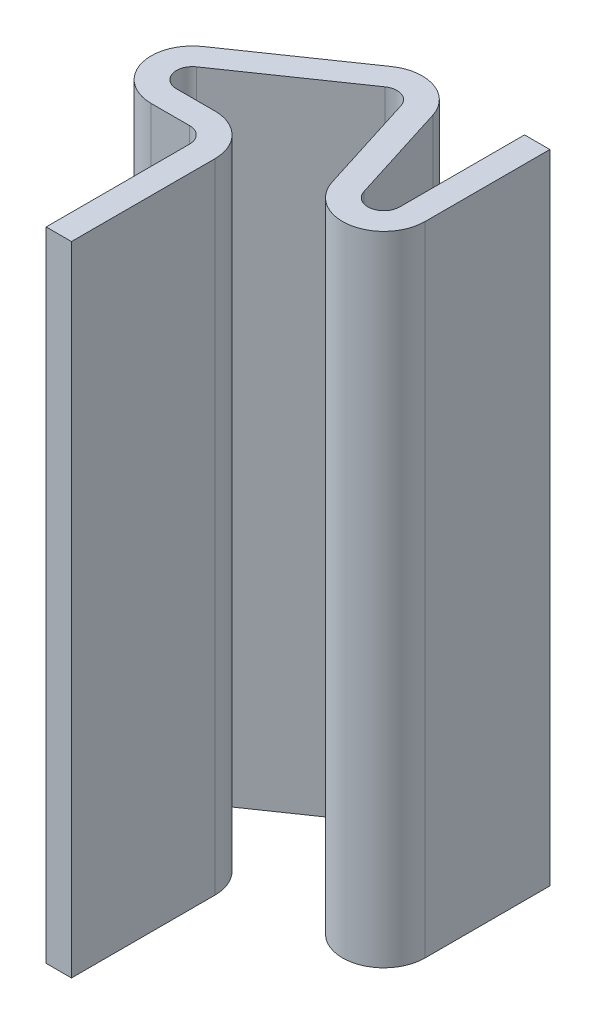
from build123d import *

# Parameters (mm, degrees)
BOSS_EXTRUDE1_DEPTH = 10


with BuildPart() as part:
    # Sketch1 → Boss-Extrude1 (new, symmetric)
    with BuildSketch(Plane(origin=(0, 0, 0), x_dir=(1, 0, 0), z_dir=(0, 1, 0))):
        with BuildLine():
            Line((1.29375, 0), (1.29375, -4.5))
            Line((1.29375, -4.5), (0.5, -4.5))
            Line((0.5, -4.5), (0.5, 0))
            ThreePointArc((0.5, 0), (0.353553391, 0.353553391), (0, 0.5))
            Line((0, 0.5), (-1.20625, 0.5))
            ThreePointArc((-1.20625, 0.5), (-2.441545823, 1.409259047), (-1.940487786, 2.858965441))
            Line((-1.940487786, 2.858965441), (1.559512214, 5.271465441))
            ThreePointArc((1.559512214, 5.271465441), (2.714013578, 5.429837997), (3.52755254, 4.595506155))
            Line((3.52755254, 4.595506155), (4.524019527, 1.437062839))
            ThreePointArc((4.524019527, 1.437062839), (5.076956782, 1.093325967), (5.500851427, 1.5875))
            Line((5.500851427, 1.5875), (5.500851427, 5.5))
            Line((5.500851427, 5.5), (6.294601427, 5.5))
            Line((6.294601427, 5.5), (6.294601427, 1.5875))
            ThreePointArc((6.294601427, 1.5875), (5.197774033, 0.30882469), (3.767048886, 1.198243845))
            Line((3.767048886, 1.198243845), (2.7705819, 4.356687161))
            ThreePointArc((2.7705819, 4.356687161), (2.456170707, 4.67913425), (2.009986604, 4.617927465))
            Line((2.009986604, 4.617927465), (-1.490013396, 2.205427465))
            ThreePointArc((-1.490013396, 2.205427465), (-1.683659014, 1.645154463), (-1.20625, 1.29375))
            Line((-1.20625, 1.29375), (0, 1.29375))
            ThreePointArc((0, 1.29375), (0.914819398, 0.914819398), (1.29375, 0))
        make_face()
    extrude(amount=BOSS_EXTRUDE1_DEPTH, both=True)


solid = part.part
